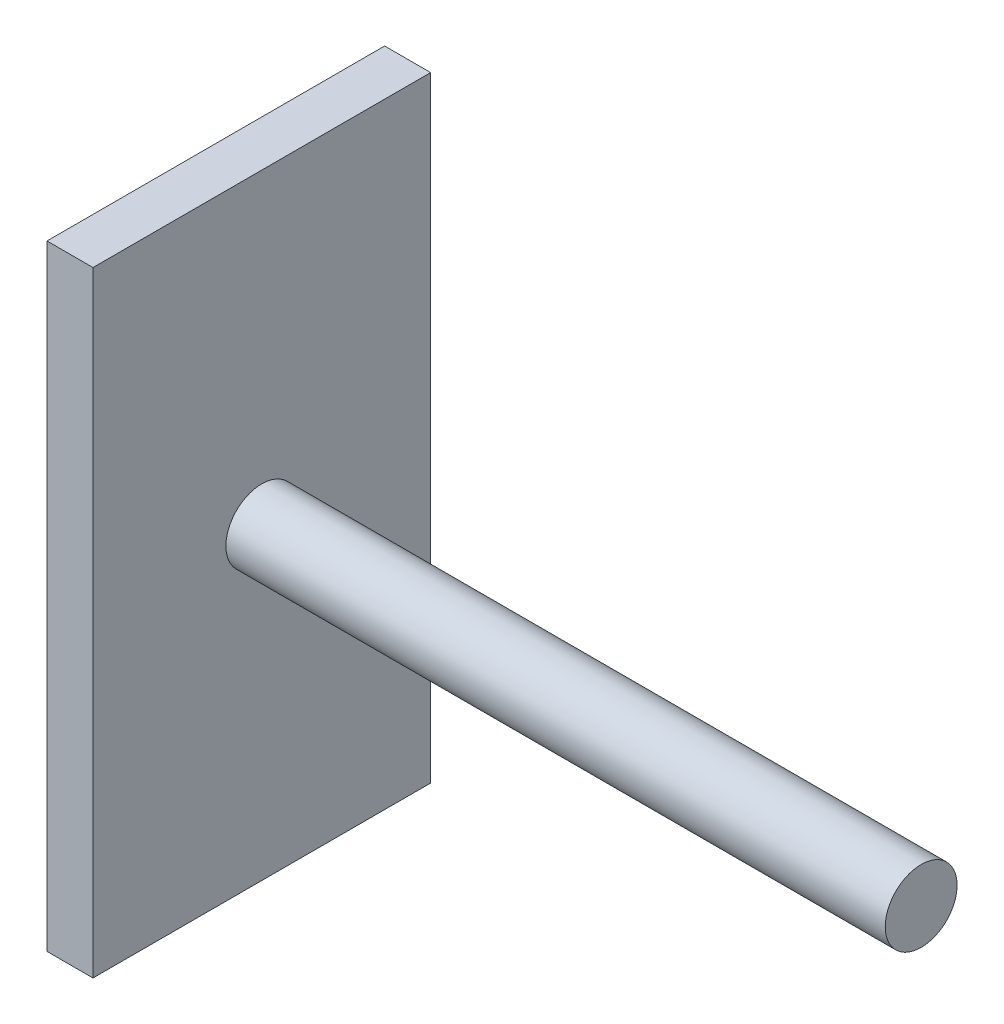
from build123d import *

# Parameters (mm, degrees)
ESQUISSE1_W        = 13.72
ESQUISSE1_H        = 25
BOSS_EXTRU_1_DEPTH = 1.87
ESQUISSE2_R        = 1.46
BOSS_EXTRU_2_DEPTH = 26.79


with BuildPart() as part:
    # Esquisse1 → Boss.-Extru.1 (new body)
    with BuildSketch(Plane(origin=(0, 0, 0), x_dir=(0, 0, -1), z_dir=(1, 0, 0))):
        with Locations((6.86, 12.5)):
            Rectangle(ESQUISSE1_W, ESQUISSE1_H)
    extrude(amount=BOSS_EXTRU_1_DEPTH)

    # Esquisse2 → Boss.-Extru.2 (add)
    with BuildSketch(Plane(origin=(1.87, 0, 0), x_dir=(0, 0, -1), z_dir=(1, 0, 0))):
        with Locations(Location((6.86, 12.5, 0), (0, 0, 180))):
            Circle(ESQUISSE2_R)
    extrude(amount=BOSS_EXTRU_2_DEPTH)


solid = part.part
